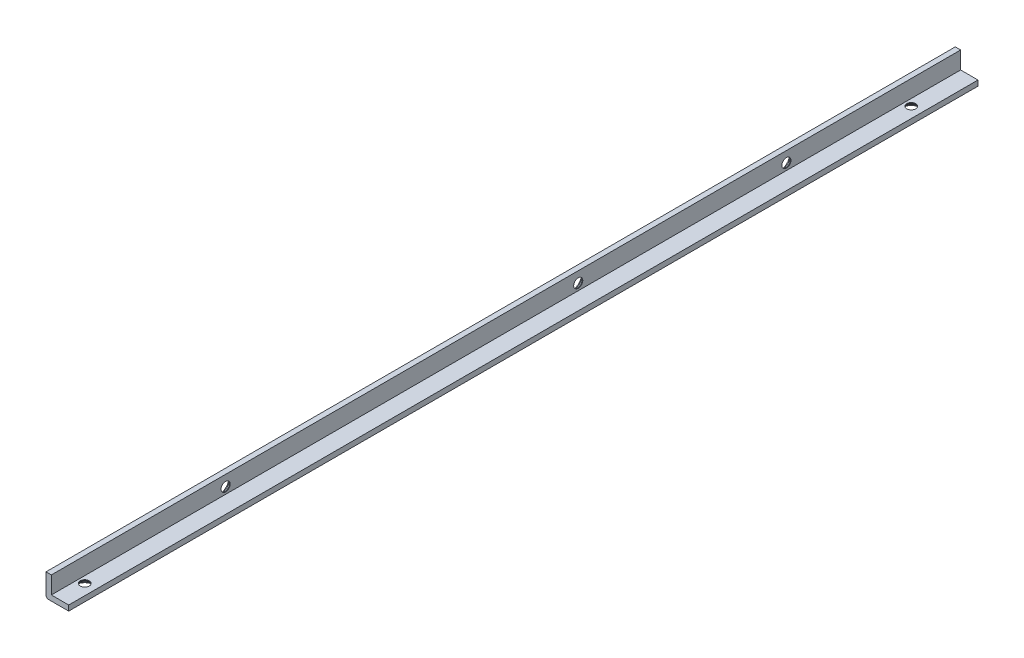
from build123d import *

# Parameters (mm, degrees)
BOSS_EXTRUDE1_DEPTH = 340.5
FILLET1_R           = 1


with BuildPart() as part:
    # Sketch1 → Boss-Extrude1 (new body)
    with BuildSketch(Plane.XY):
        Polygon((0, 0), (-8.5, 0), (-8.5, 8.5), (-6.5, 8.5), (-6.5, 2), (0, 2), align=None)
    extrude(amount=BOSS_EXTRUDE1_DEPTH)

    # Fillet1
    fillet1_edges = [part.edges().sort_by_distance(p)[0] for p in [
        (-8.5, 0, 170.25),
    ]]
    fillet(fillet1_edges, radius=FILLET1_R)

    # Sketch7 → CSK for M3 Countersunk Flat Head Screw1 (revolve, cut)
    with BuildSketch(Plane(origin=(-4, 0, 330.5), x_dir=(0, 0, -1), z_dir=(1, 0, 0))):
        Polygon((0, 0), (0, 10.521463052), (1.7, 9.5), (1.7, 1.75), (3.15, 0.3), (3.15, 0), align=None)
    revolve(axis=Axis((-4, -6.35, 330.5), (0, 1, 0)), mode=Mode.SUBTRACT)

    # Sketch7 at point 2 (carried to point 2, square into its face) → CSK for M3 Countersunk Flat Head Scr 2 (revolve, cut)
    with BuildSketch(Plane(origin=(-8.5, 4.5, 275.25), x_dir=(0, 0, -1), z_dir=(0, -1, 0))):
        Polygon((0, 0), (0, 10.521463052), (1.7, 9.5), (1.7, 1.75), (3.15, 0.3), (3.15, 0), align=None)
    revolve(axis=Axis((-14.85, 4.5, 275.25), (1, 0, 0)), mode=Mode.SUBTRACT)

    # Sketch7 at point 3 (carried to point 3, square into its face) → CSK for M3 Countersunk Flat Head Scr 3 (revolve, cut)
    with BuildSketch(Plane(origin=(-8.5, 4.5, 143.19999924), x_dir=(0, 0, -1), z_dir=(0, -1, 0))):
        Polygon((0, 0), (0, 10.521463052), (1.7, 9.5), (1.7, 1.75), (3.15, 0.3), (3.15, 0), align=None)
    revolve(axis=Axis((-14.85, 4.5, 143.19999924), (1, 0, 0)), mode=Mode.SUBTRACT)

    # Sketch7 at point 4 (carried to point 4, square into its face) → CSK for M3 Countersunk Flat Head Scr 4 (revolve, cut)
    with BuildSketch(Plane(origin=(-8.5, 4.5, 65.25), x_dir=(0, 0, -1), z_dir=(0, -1, 0))):
        Polygon((0, 0), (0, 10.521463052), (1.7, 9.5), (1.7, 1.75), (3.15, 0.3), (3.15, 0), align=None)
    revolve(axis=Axis((-14.85, 4.5, 65.25), (1, 0, 0)), mode=Mode.SUBTRACT)

    # Sketch7 at point 5 (carried to point 5, square into its face) → CSK for M3 Countersunk Flat Head Scr 5 (revolve, cut)
    with BuildSketch(Plane(origin=(-4, 0, 21), x_dir=(0, 0, -1), z_dir=(1, 0, 0))):
        Polygon((0, 0), (0, 10.521463052), (1.7, 9.5), (1.7, 1.75), (3.15, 0.3), (3.15, 0), align=None)
    revolve(axis=Axis((-4, -6.35, 21), (0, 1, 0)), mode=Mode.SUBTRACT)


solid = part.part
